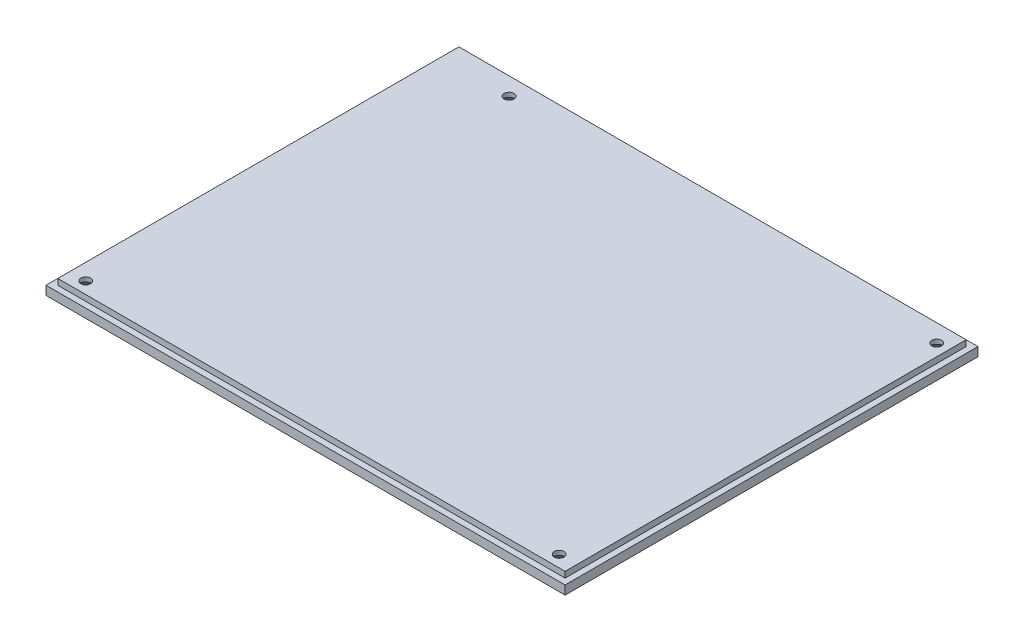
from build123d import *

# Parameters (mm, degrees)
SKETCH1_W                                         = 88
SKETCH1_H                                         = 70
BOSS_EXTRUDE2_DEPTH                               = 1.5
SKETCH7_W                                         = 86
SKETCH7_H                                         = 68
BOSS_EXTRUDE3_DEPTH                               = 1
CSK_FOR_M2_5_FLAT_HEAD_MACHINE_SCREW1_D           = 2.9
CSK_FOR_M2_5_FLAT_HEAD_MACHINE_SCREW1_DEPTH       = 2.128752102
CSK_FOR_M2_5_FLAT_HEAD_MACHINE_SCREW1_CSINK_D     = 5.5
CSK_FOR_M2_5_FLAT_HEAD_MACHINE_SCREW1_CSINK_ANGLE = 90
CSK_FOR_M2_5_FLAT_HEAD_MACHINE_SCREW1_TIP         = 0.871247898


with BuildPart() as part:
    # Sketch1 → Boss-Extrude2 (new body)
    with BuildSketch(Plane(origin=(0, 0, 0), x_dir=(1, 0, 0), z_dir=(0, 1, 0))):
        Rectangle(SKETCH1_W, SKETCH1_H)
    extrude(amount=BOSS_EXTRUDE2_DEPTH)

    # Sketch7 → Boss-Extrude3 (add)
    with BuildSketch(Plane(origin=(0, 1.5, 0), x_dir=(1, 0, 0), z_dir=(0, 1, 0))):
        Rectangle(SKETCH7_W, SKETCH7_H)
    extrude(amount=BOSS_EXTRUDE3_DEPTH)

    # CSK for M2.5 Flat Head Machine Screw1
    with Locations(Plane(origin=(0, 0, 0), x_dir=(-1, 0, 0), z_dir=(0, -1, 0))):
        with Locations((-40, -32), (-41, 31), (31.5, 31), (40.268, -32)):
            CounterSinkHole(CSK_FOR_M2_5_FLAT_HEAD_MACHINE_SCREW1_D / 2, CSK_FOR_M2_5_FLAT_HEAD_MACHINE_SCREW1_CSINK_D / 2, depth=CSK_FOR_M2_5_FLAT_HEAD_MACHINE_SCREW1_DEPTH, counter_sink_angle=CSK_FOR_M2_5_FLAT_HEAD_MACHINE_SCREW1_CSINK_ANGLE)
            with Locations((0, 0, -(CSK_FOR_M2_5_FLAT_HEAD_MACHINE_SCREW1_DEPTH + CSK_FOR_M2_5_FLAT_HEAD_MACHINE_SCREW1_TIP / 2))):  # 118° drill point
                Cone(0, CSK_FOR_M2_5_FLAT_HEAD_MACHINE_SCREW1_D / 2, CSK_FOR_M2_5_FLAT_HEAD_MACHINE_SCREW1_TIP, mode=Mode.SUBTRACT)


solid = part.part
